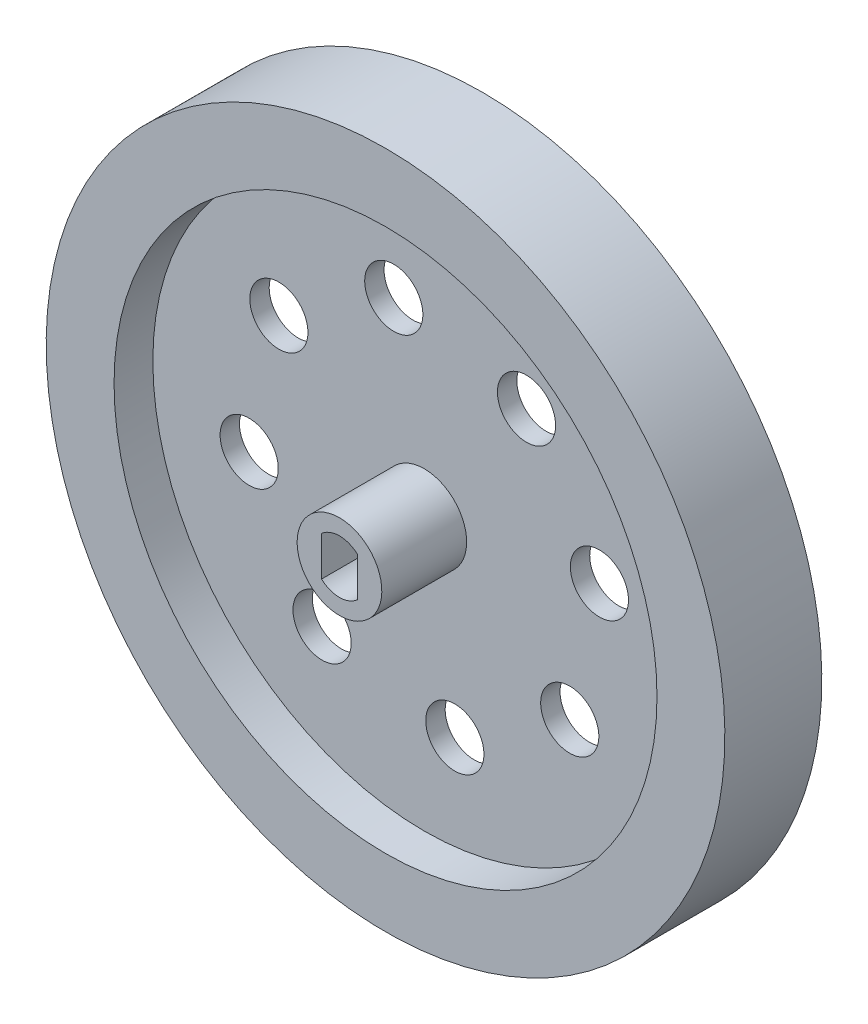
from build123d import *

# Parameters (mm, degrees)
SKETCH2_R          = 3
CUT_EXTRUDE1_DEPTH = 2
CUT_EXTRUDE2_DEPTH = 8.75
SKETCH4_R          = 0.95
CUT_EXTRUDE3_DEPTH = 2


with BuildPart() as part:
    # Sketch1 → Revolve1 (revolve)
    with BuildSketch(Plane(origin=(0, 0, 0), x_dir=(0, 0, -1), z_dir=(1, 0, 0))):
        Polygon((0, 0), (-9.75, 0), (-9.75, 4.367299354), (-1, 4.367299354), (-1, 28), (-5, 28), (-5, 35), (5, 35), (5, 28), (1, 28), (1, 0), align=None)
    revolve(axis=Axis((0, 0, 0), (0, 0, 1)))

    # Sketch2 → Cut-Extrude1 (cut)
    with BuildSketch(Plane(origin=(0, 0, -1), x_dir=(-1, 0, 0), z_dir=(0, 0, -1))):
        with Locations((-10.543910988, 15)):
            Circle(SKETCH2_R)
        with Locations((3.150930758, 18.062272677)):
            Circle(SKETCH2_R)
        with Locations((15, 10.543910988)):
            Circle(SKETCH2_R)
        with Locations((18.062272677, -3.150930758)):
            Circle(SKETCH2_R)
        with Locations((10.543910988, -15)):
            Circle(SKETCH2_R)
        with Locations((-3.150930758, -18.062272677)):
            Circle(SKETCH2_R)
        with Locations((-15, -10.543910988)):
            Circle(SKETCH2_R)
        with Locations((-18.062272677, 3.150930758)):
            Circle(SKETCH2_R)
    extrude(amount=-CUT_EXTRUDE1_DEPTH, mode=Mode.SUBTRACT)

    # Sketch3 → Cut-Extrude2 (cut)
    with BuildSketch(Plane.XY.offset(9.75)):
        with BuildLine():
            Line((1.85, -2.034698995), (1.85, 2.034698995))
            ThreePointArc((1.85, 2.034698995), (0, 2.75), (-1.85, 2.034698995))
            Line((-1.85, 2.034698995), (-1.85, -2.034698995))
            ThreePointArc((-1.85, -2.034698995), (0, -2.75), (1.85, -2.034698995))
        make_face()
    extrude(amount=-CUT_EXTRUDE2_DEPTH, mode=Mode.SUBTRACT)

    # Sketch4 → Cut-Extrude3 (cut)
    with BuildSketch(Plane(origin=(0, 0, -1), x_dir=(-1, 0, 0), z_dir=(0, 0, -1))):
        Circle(SKETCH4_R)
    extrude(amount=-CUT_EXTRUDE3_DEPTH, mode=Mode.SUBTRACT)


solid = part.part
